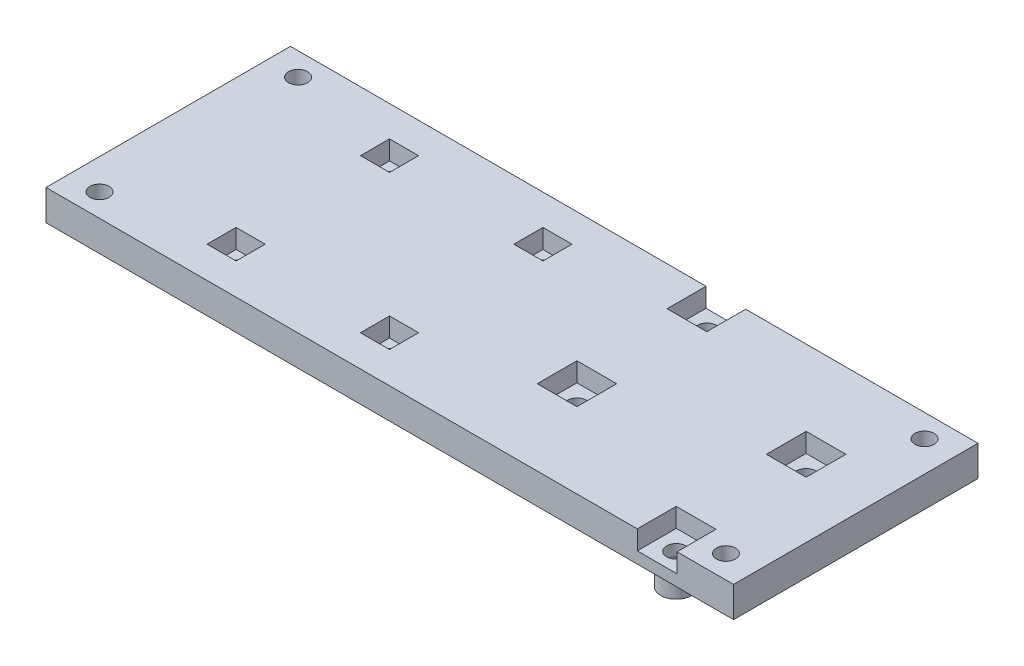
from build123d import *

# Parameters (mm, degrees)
SKETCH1_W           = 114.3
SKETCH1_H           = 40.64
BOSS_EXTRUDE1_DEPTH = 5.08
SKETCH2_R           = 1.5875
CUT_EXTRUDE1_DEPTH  = 84.991521289
SKETCH5_R           = 1.5875
CUT_EXTRUDE2_DEPTH  = 84.991521289
BOSS_EXTRUDE2_START = 3.175
SKETCH6_R           = 2.575286713
SKETCH6_R_2         = 1.755660025
SKETCH6_R_3         = 2.467274827
SKETCH6_R_4         = 1.5875
SKETCH6_R_5         = 2.529262395
SKETCH6_R_6         = 2.491560895
BOSS_EXTRUDE2_DEPTH = 3.175
SKETCH7_R           = 1.27
CUT_EXTRUDE3_DEPTH  = 84.991521289
BOSS_EXTRUDE3_START = 3.175
SKETCH8_R           = 2.037414518
SKETCH8_R_2         = 1.27
SKETCH8_R_3         = 2.098900923
SKETCH8_R_4         = 1.95707153
SKETCH8_R_5         = 2.085151837
BOSS_EXTRUDE3_DEPTH = 3.175
SKETCH9_W           = 6.604
SKETCH9_H           = 6.604
SKETCH9_W_2         = 4.826
SKETCH9_H_2         = 4.826
CUT_EXTRUDE4_DEPTH  = 3.175


with BuildPart() as part:
    # Sketch1 → Boss-Extrude1 (new body)
    with BuildSketch(Plane(origin=(0, 0, 0), x_dir=(1, 0, 0), z_dir=(0, 1, 0))):
        with Locations((19.44536493, 13.766937669)):
            Rectangle(SKETCH1_W, SKETCH1_H)
    extrude(amount=BOSS_EXTRUDE1_DEPTH)

    # Sketch2 → Cut-Extrude1 (cut, through all)
    with BuildSketch(Plane(origin=(0, 5.08, 0), x_dir=(1, 0, 0), z_dir=(0, 1, 0))):
        with Locations(Location((-32.62463507, 30.276937669, 0), (0, 0, 270))):
            Circle(SKETCH2_R)
        with Locations(Location((71.51536493, 30.276937669, 0), (0, 0, 270))):
            Circle(SKETCH2_R)
        with Locations(Location((71.51536493, -2.743062331, 0), (0, 0, 270))):
            Circle(SKETCH2_R)
        with Locations(Location((-32.62463507, -2.743062331, 0), (0, 0, 270))):
            Circle(SKETCH2_R)
    extrude(amount=-CUT_EXTRUDE1_DEPTH, mode=Mode.SUBTRACT)

    # Sketch5 → Cut-Extrude2 (cut, through all)
    with BuildSketch(Plane.XZ):
        with Locations(Location((63.89536493, 3.378062331, 0), (0, 0, 270))):
            Circle(SKETCH5_R)
        with Locations(Location((34.68536493, -9.321937669, 0), (0, 0, 270))):
            Circle(SKETCH5_R)
        with Locations(Location((63.89536493, -18.211937669, 0), (0, 0, 270))):
            Circle(SKETCH5_R)
        with Locations(Location((34.68536493, -30.911937669, 0), (0, 0, 270))):
            Circle(SKETCH5_R)
    extrude(amount=-CUT_EXTRUDE2_DEPTH, mode=Mode.SUBTRACT)

    # Sketch6 → Boss-Extrude2 (add)
    # profile 1 of 4: a face of its own
    with BuildSketch(Plane.XZ.offset(BOSS_EXTRUDE2_START)):
        with Locations(Location((63.89536493, 3.378062331, 0), (0, 0, 270))):
            Circle(SKETCH6_R)
        with Locations(Location((63.89536493, 3.378062331, 0), (0, 0, 270))):
            Circle(SKETCH6_R_2, mode=Mode.SUBTRACT)
    # profile 2 of 4: a face of its own
    with BuildSketch(Plane.XZ.offset(BOSS_EXTRUDE2_START)):
        with Locations(Location((63.89536493, -18.211937669, 0), (0, 0, 270))):
            Circle(SKETCH6_R_3)
        with Locations(Location((63.89536493, -18.211937669, 0), (0, 0, 270))):
            Circle(SKETCH6_R_4, mode=Mode.SUBTRACT)
    # profile 3 of 4: a face of its own
    with BuildSketch(Plane.XZ.offset(BOSS_EXTRUDE2_START)):
        with Locations(Location((34.68536493, -9.321937669, 0), (0, 0, 270))):
            Circle(SKETCH6_R_5)
        with Locations(Location((34.68536493, -9.321937669, 0), (0, 0, 270))):
            Circle(SKETCH6_R_4, mode=Mode.SUBTRACT)
    # profile 4 of 4: a face of its own
    with BuildSketch(Plane.XZ.offset(BOSS_EXTRUDE2_START)):
        with Locations(Location((34.68536493, -30.911937669, 0), (0, 0, 270))):
            Circle(SKETCH6_R_6)
        with Locations(Location((34.68536493, -30.911937669, 0), (0, 0, 270))):
            Circle(SKETCH6_R_4, mode=Mode.SUBTRACT)
    extrude(amount=-BOSS_EXTRUDE2_DEPTH)

    # Sketch7 → Cut-Extrude3 (cut, through all)
    with BuildSketch(Plane.XZ):
        with Locations(Location((11.764327972, -1.084047056, 0), (0, 0, 270))):
            Circle(SKETCH7_R)
        with Locations(Location((11.771660973, -26.584045801, 0), (0, 0, 270))):
            Circle(SKETCH7_R)
        with Locations(Location((-13.735671828, -1.084047056, 0), (0, 0, 270))):
            Circle(SKETCH7_R)
        with Locations(Location((-13.728338827, -26.584045801, 0), (0, 0, 270))):
            Circle(SKETCH7_R)
    extrude(amount=-CUT_EXTRUDE3_DEPTH, mode=Mode.SUBTRACT)

    # Sketch8 → Boss-Extrude3 (add)
    # profile 1 of 4: a face of its own
    with BuildSketch(Plane.XZ.offset(BOSS_EXTRUDE3_START)):
        with Locations(Location((-13.735671828, -1.084047056, 0), (0, 0, 270))):
            Circle(SKETCH8_R)
        with Locations(Location((-13.735671828, -1.084047056, 0), (0, 0, 270))):
            Circle(SKETCH8_R_2, mode=Mode.SUBTRACT)
    # profile 2 of 4: a face of its own
    with BuildSketch(Plane.XZ.offset(BOSS_EXTRUDE3_START)):
        with Locations(Location((11.764327972, -1.084047056, 0), (0, 0, 270))):
            Circle(SKETCH8_R_3)
        with Locations(Location((11.764327972, -1.084047056, 0), (0, 0, 270))):
            Circle(SKETCH8_R_2, mode=Mode.SUBTRACT)
    # profile 3 of 4: a face of its own
    with BuildSketch(Plane.XZ.offset(BOSS_EXTRUDE3_START)):
        with Locations(Location((11.771660973, -26.584045801, 0), (0, 0, 270))):
            Circle(SKETCH8_R_4)
        with Locations(Location((11.771660973, -26.584045801, 0), (0, 0, 270))):
            Circle(SKETCH8_R_2, mode=Mode.SUBTRACT)
    # profile 4 of 4: a face of its own
    with BuildSketch(Plane.XZ.offset(BOSS_EXTRUDE3_START)):
        with Locations(Location((-13.728338827, -26.584045801, 0), (0, 0, 270))):
            Circle(SKETCH8_R_5)
        with Locations(Location((-13.728338827, -26.584045801, 0), (0, 0, 270))):
            Circle(SKETCH8_R_2, mode=Mode.SUBTRACT)
    extrude(amount=-BOSS_EXTRUDE3_DEPTH)

    # Sketch9 → Cut-Extrude4 (cut)
    with BuildSketch(Plane(origin=(0, 5.08, 0), x_dir=(1, 0, 0), z_dir=(0, 1, 0))):
        with Locations((63.89536493, 18.211937669)):
            Rectangle(SKETCH9_W, SKETCH9_H)
        with Locations((63.89536493, -3.378062331)):
            Rectangle(SKETCH9_W, SKETCH9_H)
        with Locations((34.68536493, 9.321937669)):
            Rectangle(SKETCH9_W, SKETCH9_H)
        with Locations((34.68536493, 30.911937669)):
            Rectangle(SKETCH9_W, SKETCH9_H)
        with Locations((-13.728338827, 26.584045801)):
            Rectangle(SKETCH9_W_2, SKETCH9_H_2)
        with Locations((11.771660973, 26.584045801)):
            Rectangle(SKETCH9_W_2, SKETCH9_H_2)
        with Locations((-13.735671828, 1.084047056)):
            Rectangle(SKETCH9_W_2, SKETCH9_H_2)
        with Locations((11.764327972, 1.084047056)):
            Rectangle(SKETCH9_W_2, SKETCH9_H_2)
    extrude(amount=-CUT_EXTRUDE4_DEPTH, mode=Mode.SUBTRACT)


solid = part.part
